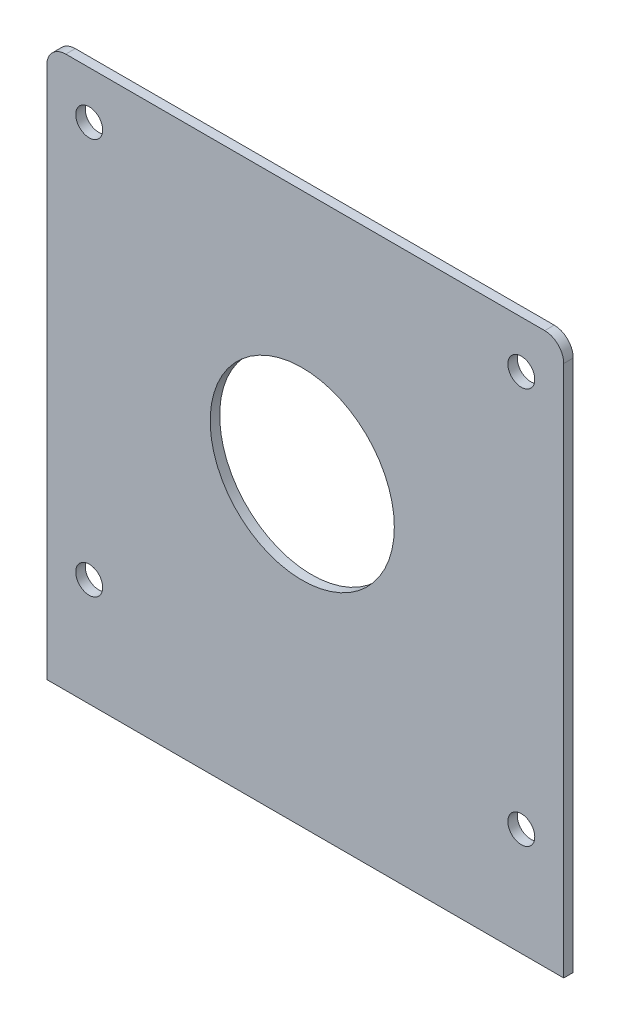
from build123d import *

# Parameters (mm, degrees)
SKETCH2_W            = 86.36
SKETCH2_H            = 85.725
BOSS_EXTRUDE1_DEPTH  = 0.79375
SKETCH3_R            = 15.380999972
CUT_EXTRUDE1_DEPTH   = 61.862356695
M4_CLEARANCE_HOLE1_D = 4.5
SKETCH5_W            = 86.36
SKETCH5_H            = 6.35
BOSS_EXTRUDE2_DEPTH  = 1.5875
FILLET1_R            = 3.175


with BuildPart() as part:
    # Sketch2 → Boss-Extrude1 (new, symmetric)
    with BuildSketch(Plane.XY):
        Rectangle(SKETCH2_W, SKETCH2_H)
    extrude(amount=BOSS_EXTRUDE1_DEPTH, both=True)

    # Sketch3 → Cut-Extrude1 (cut, through all)
    with BuildSketch(Plane.XY.offset(0.79375)):
        with Locations((-0.5, 1.8625)):
            Circle(SKETCH3_R)
    extrude(amount=-CUT_EXTRUDE1_DEPTH, mode=Mode.SUBTRACT)

    # M4 Clearance Hole1 (through all)
    with Locations(Plane(origin=(36.09137025, 34.95387025, 0.79375), x_dir=(1, 0, 0), z_dir=(0, 0, 1))):
        with Locations((0, 0), (0, -66.1827405), (-72.1827405, 0), (-72.1827405, -66.1827405)):
            Hole(M4_CLEARANCE_HOLE1_D / 2)

    # Sketch5 → Boss-Extrude2 (add)
    with BuildSketch(Plane.XY.offset(0.79375)):
        with Locations((0, -46.0375)):
            Rectangle(SKETCH5_W, SKETCH5_H)
    extrude(amount=-BOSS_EXTRUDE2_DEPTH)

    # Fillet1
    fillet1_edges = [part.edges().sort_by_distance(p)[0] for p in [
        (-43.18, 42.8625, 0),
        (43.18, 42.8625, 0),
    ]]
    fillet(fillet1_edges, radius=FILLET1_R)


solid = part.part
